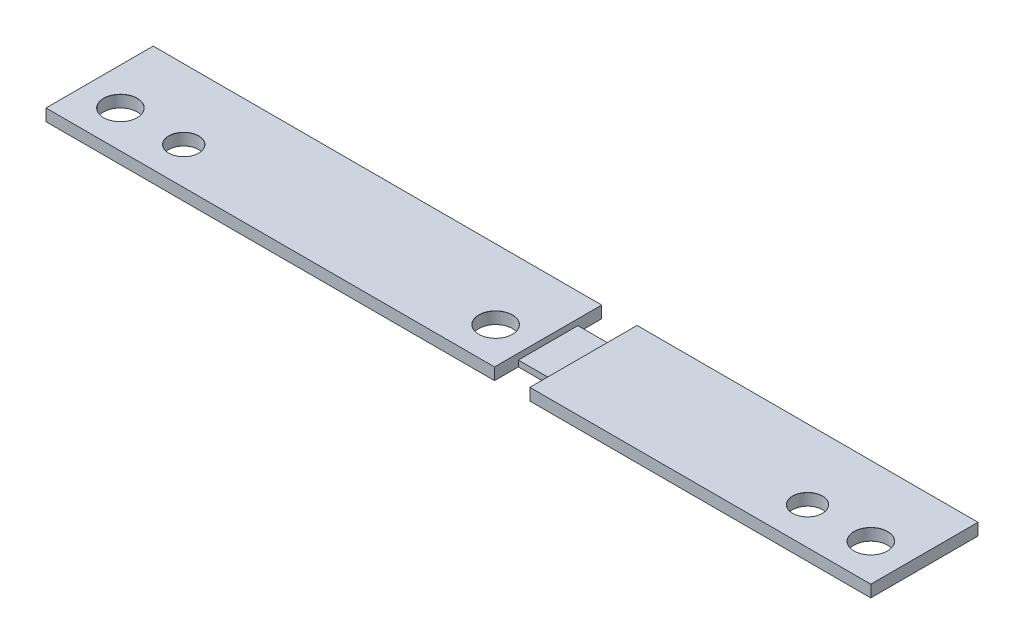
from build123d import *

# Parameters (mm, degrees)
SKETCH1_W                      = 221.6
SKETCH1_H                      = 28.8
BOSS_EXTRUDE1_DEPTH            = 3.2
CUT_EXTRUDE1_REACH             = 113.778
SKETCH2_W                      = 9.5
SKETCH2_H                      = 6.4
CUT_EXTRUDE2_REACH             = 115.087
SKETCH3_W                      = 9.5
SKETCH3_H                      = 1.6
M8_CLEARANCE_HOLE1_AT_2_COUNT  = 2
M8_CLEARANCE_HOLE1_AT_2_PITCH  = 201.6
M8_CLEARANCE_HOLE1_AT_3_COUNT  = 2
M8_CLEARANCE_HOLE1_AT_3_PITCH  = 100.8
F_8_0MM_DOWEL_HOLE1_AT_2_COUNT = 2
F_8_0MM_DOWEL_HOLE1_AT_2_PITCH = 167.6


with BuildPart() as part:
    # Sketch1 → Boss-Extrude1 (new body)
    with BuildSketch(Plane(origin=(0, 0, 0), x_dir=(1, 0, 0), z_dir=(0, 1, 0))):
        Rectangle(SKETCH1_W, SKETCH1_H)
    extrude(amount=-BOSS_EXTRUDE1_DEPTH)

    # Sketch2 → Cut-Extrude1 (cut, up to next)
    with BuildSketch(Plane(origin=(0, 0, 0), x_dir=(1, 0, 0), z_dir=(0, 1, 0)), mode=Mode.PRIVATE) as cut_extrude1_sk1:
        with Locations((14.45, 11.2)):
            Rectangle(SKETCH2_W, SKETCH2_H)
    cut_extrude1_tool1 = extrude(cut_extrude1_sk1.sketch, amount=-CUT_EXTRUDE1_REACH, mode=Mode.PRIVATE) & part.part
    # Sketch2 → Cut-Extrude1 (cut, up to next)
    with BuildSketch(Plane(origin=(0, 0, 0), x_dir=(1, 0, 0), z_dir=(0, 1, 0)), mode=Mode.PRIVATE) as cut_extrude1_sk2:
        with Locations((14.45, -11.2)):
            Rectangle(SKETCH2_W, SKETCH2_H)
    cut_extrude1_tool2 = extrude(cut_extrude1_sk2.sketch, amount=-CUT_EXTRUDE1_REACH, mode=Mode.PRIVATE) & part.part
    add(cut_extrude1_tool1.solids().sort_by_distance((14.45, 0, -11.2))[0], mode=Mode.SUBTRACT)
    add(cut_extrude1_tool2.solids().sort_by_distance((14.45, 0, 11.2))[0], mode=Mode.SUBTRACT)

    # Sketch3 → Cut-Extrude2 (cut, up to next)
    with BuildSketch(Plane.XY.offset(8), mode=Mode.PRIVATE) as cut_extrude2_sk1:
        with Locations((14.45, -0.8)):
            Rectangle(SKETCH3_W, SKETCH3_H)
    cut_extrude2_tool1 = extrude(cut_extrude2_sk1.sketch, amount=-CUT_EXTRUDE2_REACH, mode=Mode.PRIVATE) & part.part
    add(cut_extrude2_tool1.solids().sort_by_distance((14.45, -0.8, 8))[0], mode=Mode.SUBTRACT)

    # Sketch5 → M8 Clearance Hole1 (revolve, cut)
    with BuildSketch(Plane(origin=(-100.8, 0, 4.4), x_dir=(0, 0, 1), z_dir=(1, 0, 0))):
        Polygon((0, 0), (0, 3.2), (4.525, 3.2), (4.5, 3.175), (4.5, 0.025), (4.525, 0), align=None)
    m8_clearance_hole1 = revolve(axis=Axis((-100.8, 6.35, 4.4), (0, -1, 0)), mode=Mode.SUBTRACT)

    # M8 Clearance Hole1 at 2: M8 Clearance Hole1 ×2
    with Locations(*[(i * M8_CLEARANCE_HOLE1_AT_2_PITCH, 0, 0) for i in range(1, M8_CLEARANCE_HOLE1_AT_2_COUNT)]):
        add(m8_clearance_hole1, mode=Mode.SUBTRACT)

    # M8 Clearance Hole1 at 3: M8 Clearance Hole1 ×2
    with Locations(*[(i * M8_CLEARANCE_HOLE1_AT_3_PITCH, 0, 0) for i in range(1, M8_CLEARANCE_HOLE1_AT_3_COUNT)]):
        add(m8_clearance_hole1, mode=Mode.SUBTRACT)

    # Sketch7 → Ø8.0mm Dowel Hole1 (revolve, cut)
    with BuildSketch(Plane(origin=(83.8, 0, 4.4), x_dir=(0, 0, 1), z_dir=(1, 0, 0))):
        Polygon((0, 0), (0, 3.2), (4.025, 3.2), (4, 3.175), (4, 0.025), (4.025, 0), align=None)
    f_8_0mm_dowel_hole1 = revolve(axis=Axis((83.8, 6.35, 4.4), (0, -1, 0)), mode=Mode.SUBTRACT)

    # Ø8.0mm Dowel Hole1 at 2: Ø8.0mm Dowel Hole1 ×2
    with Locations(*[(-i * F_8_0MM_DOWEL_HOLE1_AT_2_PITCH, 0, 0) for i in range(1, F_8_0MM_DOWEL_HOLE1_AT_2_COUNT)]):
        add(f_8_0mm_dowel_hole1, mode=Mode.SUBTRACT)


solid = part.part
